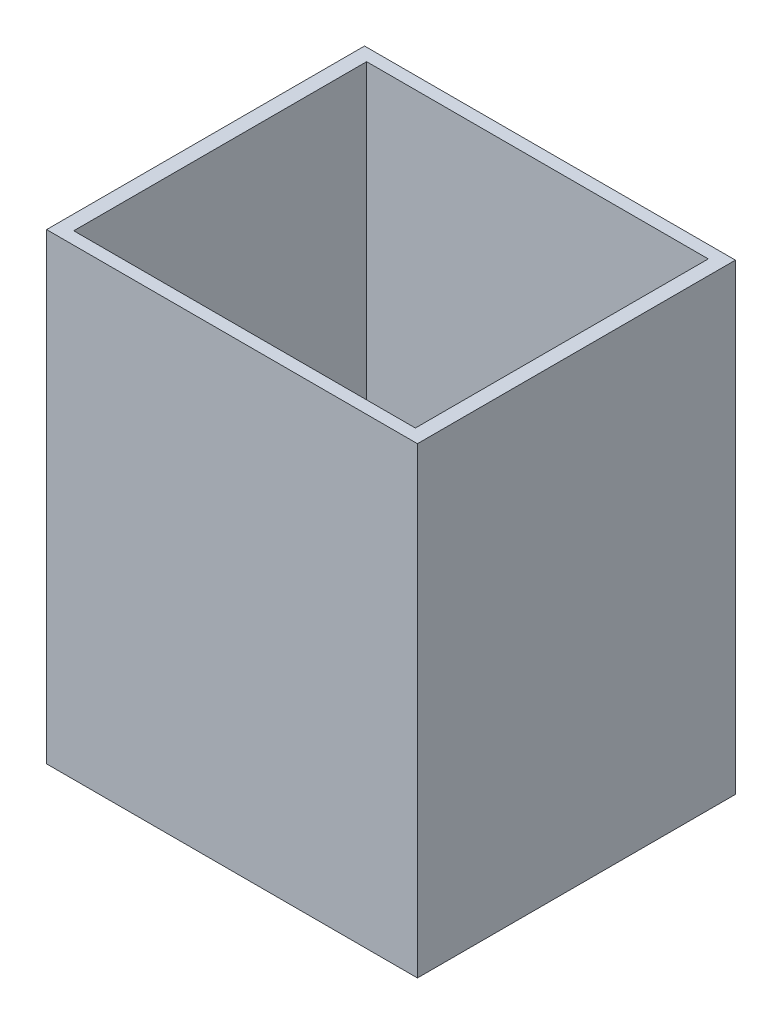
from build123d import *

# Parameters (mm, degrees)
SKETCH1_W           = 76.14
SKETCH1_H           = 65.28
BOSS_EXTRUDE1_DEPTH = 80
SKETCH3_W           = 76.14
SKETCH3_H           = 65.28
SKETCH3_W_2         = 69.86
SKETCH3_H_2         = 59.89572892
BOSS_EXTRUDE2_DEPTH = 15
SKETCH4_W           = 70.14
SKETCH4_H           = 60.135791962
CUT_EXTRUDE1_DEPTH  = 75
SKETCH5_W           = 63.58
SKETCH5_H           = 54.51145784
BOSS_EXTRUDE3_DEPTH = 15


with BuildPart() as part:
    # Sketch1 → Boss-Extrude1 (new body)
    with BuildSketch(Plane(origin=(0, 0, 0), x_dir=(1, 0, 0), z_dir=(0, 1, 0))):
        Rectangle(SKETCH1_W, SKETCH1_H)
    extrude(amount=BOSS_EXTRUDE1_DEPTH)

    # Sketch3 → Boss-Extrude2 (add)
    with BuildSketch(Plane.XZ):
        Rectangle(SKETCH3_W, SKETCH3_H)
        Rectangle(SKETCH3_W_2, SKETCH3_H_2, mode=Mode.SUBTRACT)
    extrude(amount=BOSS_EXTRUDE2_DEPTH)

    # Sketch4 → Cut-Extrude1 (cut)
    with BuildSketch(Plane(origin=(0, 80, 0), x_dir=(1, 0, 0), z_dir=(0, 1, 0))):
        Rectangle(SKETCH4_W, SKETCH4_H)
    extrude(amount=-CUT_EXTRUDE1_DEPTH, mode=Mode.SUBTRACT)

    # Sketch5 → Boss-Extrude3 (add)
    with BuildSketch(Plane.XZ):
        Rectangle(SKETCH5_W, SKETCH5_H)
    extrude(amount=BOSS_EXTRUDE3_DEPTH)


solid = part.part
